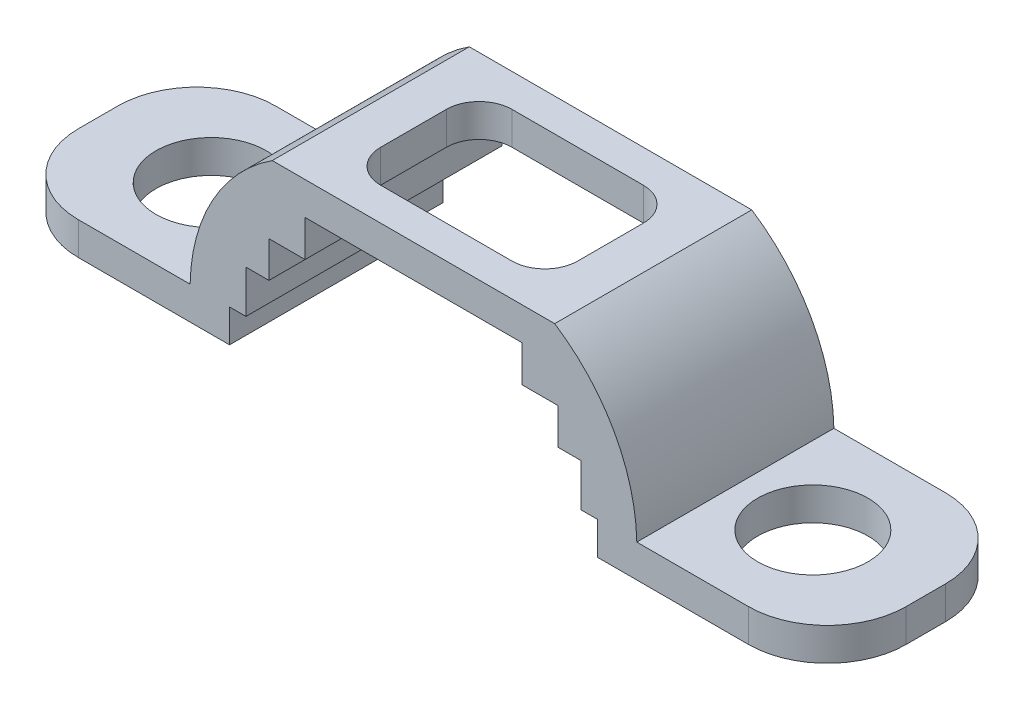
from build123d import *

# Parameters (mm, degrees)
EXTRUDE_THIN1_DEPTH  = 15
SKETCH2_R            = 8.4
CUT_EXTRUDE1_DEPTH   = 69.574794932
FILLET1_R            = 12
FILLET1_OF_MIRROR1_R = 12
SKETCH3_W            = 30
SKETCH3_H            = 20
CUT_EXTRUDE2_DEPTH   = 71.377571001
BOSS_EXTRUDE1_DEPTH  = 30
FILLET2_R            = 5


with BuildPart() as part:
    # Sketch1 → Extrude-Thin1 (new, symmetric)
    with BuildSketch(Plane.XY):
        Polygon((-63, 4.5), (-28, 4.5), (-28, 9.5), (-25.5, 9.5), (-25.5, 16), (-22, 16), (-22, 21.5), (-16.5, 21.5), (-16.5, 27.05), (0, 27.05), (0, 32.05), (-21.5, 32.05), (-21.5, 26.5), (-27, 26.5), (-27, 21), (-30.5, 21), (-30.5, 14.5), (-33, 14.5), (-33, 9.5), (-63, 9.5), align=None)
    extrude_thin1 = extrude(amount=EXTRUDE_THIN1_DEPTH, both=True)

    # Sketch2 → Cut-Extrude1 (cut, through all)
    with BuildSketch(Plane(origin=(0, 9.5, 0), x_dir=(1, 0, 0), z_dir=(0, 1, 0))):
        with Locations(Location((-45.8, 0, 0), (0, 0, 270))):
            Circle(SKETCH2_R)
    cut_extrude1 = extrude(amount=-CUT_EXTRUDE1_DEPTH, mode=Mode.SUBTRACT)

    # Fillet1
    fillet1_edges = [part.edges().sort_by_distance(p)[0] for p in [
        (-63, 7, -15),
        (-63, 7, 15),
    ]]
    fillet(fillet1_edges, radius=FILLET1_R)

    # Mirror1: Extrude-Thin1, Cut-Extrude1 across plane
    add(extrude_thin1.mirror(Plane(origin=(0, 32.05, 15), x_dir=(0, 0, 1), z_dir=(1, 0, 0))))
    add(cut_extrude1.mirror(Plane(origin=(0, 32.05, 15), x_dir=(0, 0, 1), z_dir=(1, 0, 0))), mode=Mode.SUBTRACT)

    # Fillet1 of Mirror1
    fillet1_of_mirror1_edges = [part.edges().sort_by_distance(p)[0] for p in [
        (63, 7, -15),
        (63, 7, 15),
    ]]
    fillet(fillet1_of_mirror1_edges, radius=FILLET1_OF_MIRROR1_R)

    # Sketch3 → Cut-Extrude2 (cut, through all)
    with BuildSketch(Plane(origin=(0, 32.05, 0), x_dir=(1, 0, 0), z_dir=(0, 1, 0))):
        Rectangle(SKETCH3_W, SKETCH3_H)
    extrude(amount=-CUT_EXTRUDE2_DEPTH, mode=Mode.SUBTRACT)

    # Sketch4 → Boss-Extrude1 (add)
    with BuildSketch(Plane.XY.offset(15)):
        with BuildLine():
            Line((-21.5, 26.5), (-21.5, 32.05))
            ThreePointArc((-21.5, 32.05), (-30.55647166, 22.330693825), (-34, 9.5))
            Line((-34, 9.5), (-33, 9.5))
            Line((-33, 9.5), (-33, 14.5))
            Line((-33, 14.5), (-30.5, 14.5))
            Line((-30.5, 14.5), (-30.5, 21))
            Line((-30.5, 21), (-27, 21))
            Line((-27, 21), (-27, 26.5))
            Line((-27, 26.5), (-21.5, 26.5))
        make_face()
    boss_extrude1 = extrude(amount=-BOSS_EXTRUDE1_DEPTH)

    # Mirror2: Boss-Extrude1 across plane
    add(boss_extrude1.mirror(Plane(origin=(0, 0, 0), x_dir=(0, 0, 1), z_dir=(1, 0, 0))))

    # Fillet2
    fillet2_edges = [part.edges().sort_by_distance(p)[0] for p in [
        (-15, 29.55, 10),
        (-15, 29.55, -10),
        (15, 29.55, -10),
        (15, 29.55, 10),
    ]]
    fillet(fillet2_edges, radius=FILLET2_R)


solid = part.part
